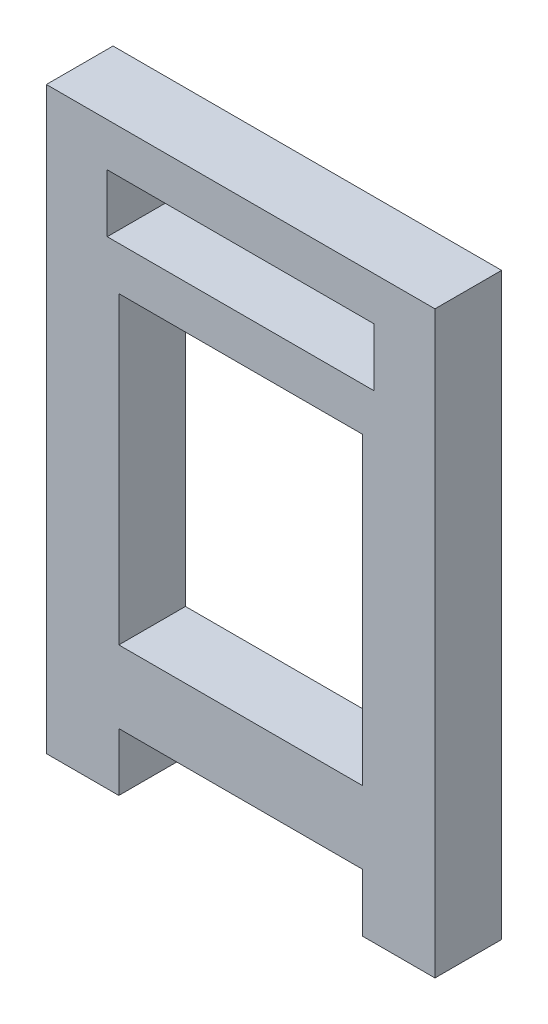
from build123d import *

# Parameters (mm, degrees)
SKETCH1_W           = 8.41
SKETCH1_H           = 10.5
SKETCH1_W_2         = 9.21
SKETCH1_H_2         = 2
BOSS_EXTRUDE1_DEPTH = 2.3


with BuildPart() as part:
    # Sketch1 → Boss-Extrude1 (new body)
    with BuildSketch(Plane.XY):
        Polygon((0, 0), (0, -2), (2.5, -2), (2.5, 0), (10.91, 0), (10.91, -2), (13.41, -2), (13.41, 0), (13.41, 18), (0, 18), align=None)
        with Locations((6.705, 7.75)):
            Rectangle(SKETCH1_W, SKETCH1_H, mode=Mode.SUBTRACT)
        with Locations((6.705, 15.5)):
            Rectangle(SKETCH1_W_2, SKETCH1_H_2, mode=Mode.SUBTRACT)
    extrude(amount=BOSS_EXTRUDE1_DEPTH)


solid = part.part
